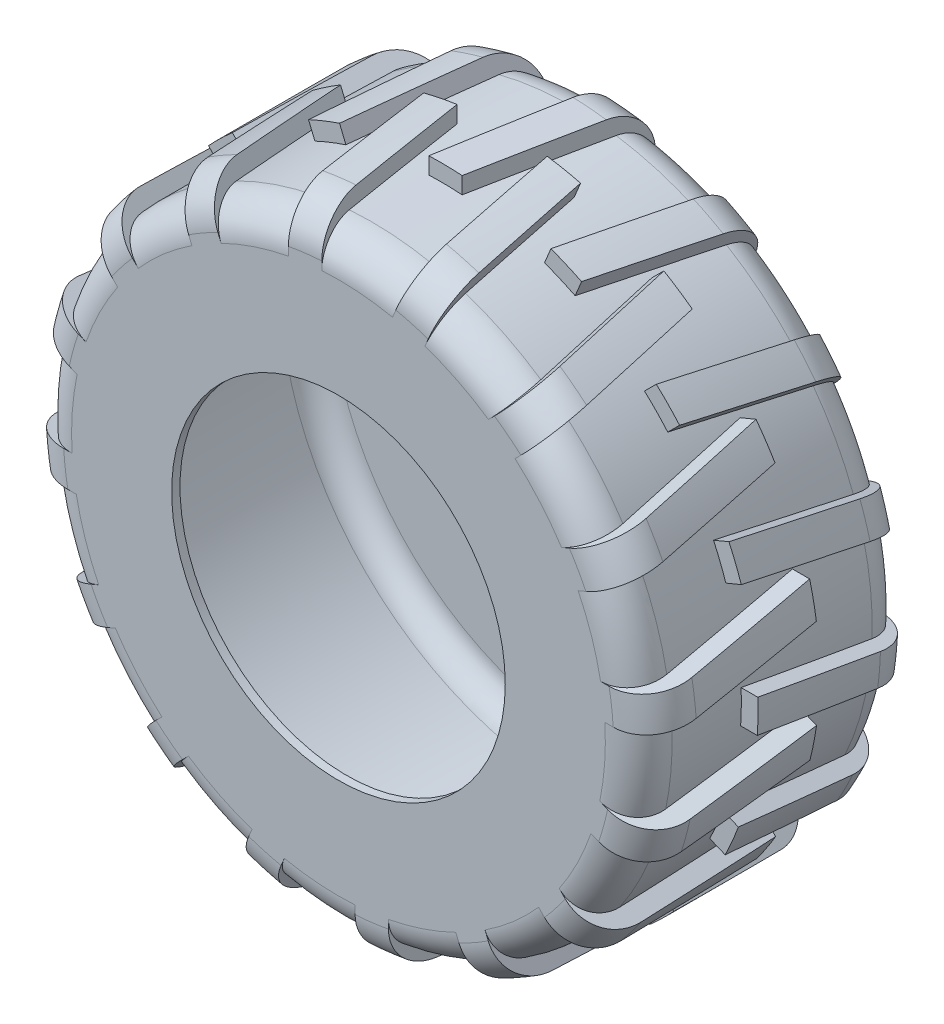
from build123d import *

# Parameters (mm, degrees)
BOSS_EXTRUDE1_REACH = 1066.681
CIRPATTERN1_COUNT   = 16


with BuildPart() as part:
    # Sketch1 → Revolve-Thin1 (revolve)
    with BuildSketch(Plane(origin=(0, 0, 0), x_dir=(0, 0, -1), z_dir=(1, 0, 0)), mode=Mode.PRIVATE) as revolve_thin1_sk:
        with BuildLine():
            Line((203.2, 254), (203.2, 406.4))
            ThreePointArc((203.2, 406.4), (188.321024484, 442.321024484), (152.4, 457.2))
            Line((152.4, 457.2), (-152.4, 457.2))
            ThreePointArc((-152.4, 457.2), (-188.321024484, 442.321024484), (-203.2, 406.4))
            Line((-203.2, 406.4), (-203.2, 254))
            Line((-203.2, 254), (-190.5, 254))
            Line((-190.5, 254), (-190.5, 406.4))
            ThreePointArc((-190.5, 406.4), (-179.340768363, 433.340768363), (-152.4, 444.5))
            Line((-152.4, 444.5), (152.4, 444.5))
            ThreePointArc((152.4, 444.5), (179.340768363, 433.340768363), (190.5, 406.4))
            Line((190.5, 406.4), (190.5, 254))
            Line((190.5, 254), (203.2, 254))
        make_face()
    revolve(revolve_thin1_sk.sketch.rotate(Axis((0, 0, 485.570877484), (0, 0, -1)), 90), axis=Axis((0, 0, 485.570877484), (0, 0, -1)))

    # Sketch2 → Boss-Extrude1 (add, up to next)
    with BuildSketch(Plane(origin=(0, 482.6, 0), x_dir=(1, 0, 0), z_dir=(0, 1, 0)), mode=Mode.PRIVATE) as boss_extrude1_sk1:
        Polygon((-18.706637127, -46.941169265), (32.093362873, -46.941169265), (76.2, 203.2), (25.4, 203.2), align=None)
    boss_extrude1_tool1 = extrude(boss_extrude1_sk1.sketch, amount=-BOSS_EXTRUDE1_REACH, mode=Mode.PRIVATE) - part.part
    # Sketch2 → Boss-Extrude1 (add, up to next)
    with BuildSketch(Plane(origin=(0, 482.6, 0), x_dir=(1, 0, 0), z_dir=(0, 1, 0)), mode=Mode.PRIVATE) as boss_extrude1_sk2:
        Polygon((-76.2, -203.2), (-25.4, -203.2), (-69.506637127, 46.941169265), (-120.306637127, 46.941169265), align=None)
    boss_extrude1_tool2 = extrude(boss_extrude1_sk2.sketch, amount=-BOSS_EXTRUDE1_REACH, mode=Mode.PRIVATE) - part.part
    boss_extrude1_1 = boss_extrude1_tool1.solids().sort_by_distance((28.746681, 482.6, -78.129415))[0]
    add(boss_extrude1_1)
    boss_extrude1_2 = boss_extrude1_tool2.solids().sort_by_distance((-72.853319, 482.6, 78.129415))[0]
    add(boss_extrude1_2)
    boss_extrude1 = boss_extrude1_1 + boss_extrude1_2  # Boss-Extrude1 as one shape, for the pattern or mirror that repeats it

    # CirPattern1: Boss-Extrude1 ×16 about axis
    cirpattern1_axis = Axis((0, 0, 0), (0, 0, 1))
    for i in range(1, CIRPATTERN1_COUNT):
        add(boss_extrude1.rotate(cirpattern1_axis, i * 360 / CIRPATTERN1_COUNT))

    # Sketch3 → Cut-Revolve4 (revolve, cut)
    with BuildSketch(Plane(origin=(0, 0, 0), x_dir=(0, 0, -1), z_dir=(1, 0, 0)), mode=Mode.PRIVATE) as cut_revolve4_sk:
        with BuildLine():
            ThreePointArc((203.2, 419.1), (184.601280605, 464.001280605), (139.7, 482.6))
            Line((139.7, 482.6), (-139.7, 482.6))
            ThreePointArc((-139.7, 482.6), (-184.601280605, 464.001280605), (-203.2, 419.1))
            Line((-203.2, 419.1), (-203.2, 647.7))
            Line((-203.2, 647.7), (203.2, 647.7))
            Line((203.2, 647.7), (203.2, 419.1))
        make_face()
    revolve(cut_revolve4_sk.sketch.rotate(Axis((0, 0, 654.539389947), (0, 0, -1)), 92.061010882), axis=Axis((0, 0, 654.539389947), (0, 0, -1)), mode=Mode.SUBTRACT)


solid = part.part
